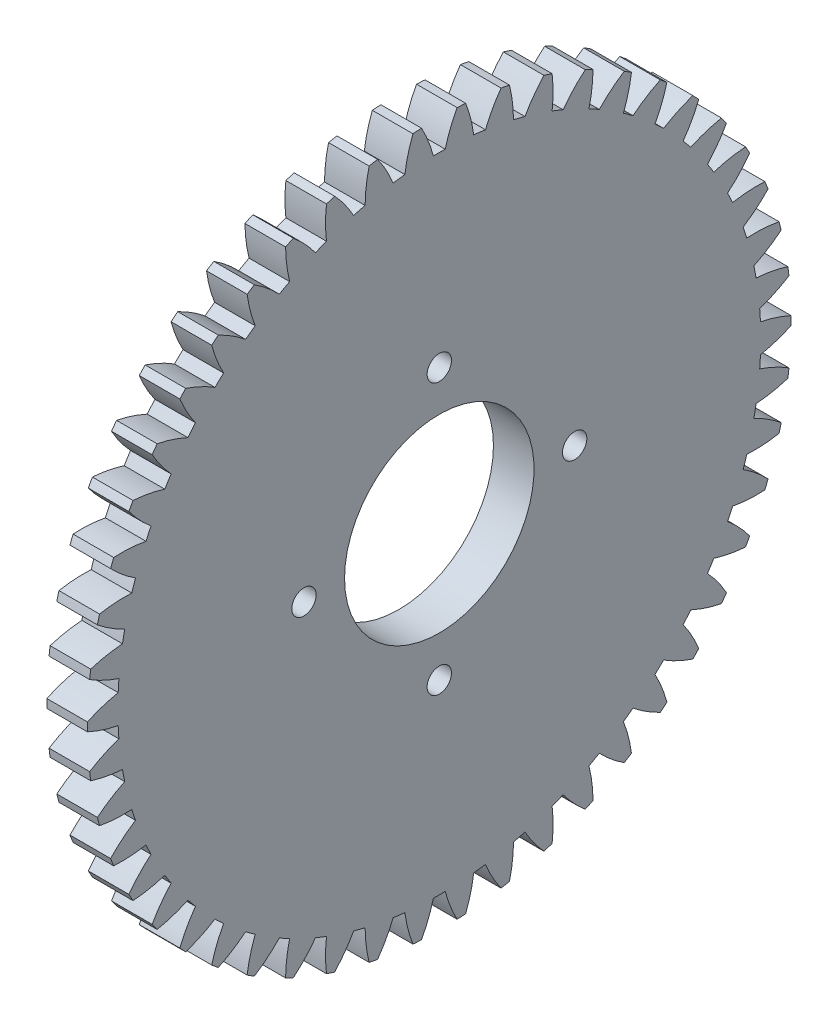
from build123d import *

# Parameters (mm, degrees)
BASPROSKE_W        = 3
BASPROSKE_H        = 26
TOOTHCUT_DEPTH     = 37.891733491
TEETHCUTS_COUNT    = 50
TEETHCUTS_ANGLE    = 352.8
HUBNEABOTSKE_R     = 0.5
HUBNEARBOTH_DEPTH  = 23.5000254
HUBFAR_START       = 23.5000254
HUBFARSKE_R        = 0.5
HUBFAR_DEPTH       = 23.5000254
BORSKE_R           = 7
BORE_DEPTH         = 50.0000508
SKETCH1_R          = 0.9
CUT_EXTRUDE1_DEPTH = 3


with BuildPart() as part:
    # BasProSke → Base-Revolve (revolve)
    with BuildSketch(Plane(origin=(0, 0, 0), x_dir=(1, 0, 0), z_dir=(0, 1, 0)), mode=Mode.PRIVATE) as base_revolve_sk:
        with Locations((1.5, 13)):
            Rectangle(BASPROSKE_W, BASPROSKE_H)
    revolve(base_revolve_sk.sketch.rotate(Axis((-10, 0, 0), (1, 0, 0)), 180), axis=Axis((-10, 0, 0), (1, 0, 0)))

    # TooCutSke → ToothCut (cut, through all)
    with BuildSketch(Plane(origin=(0, 0, 0), x_dir=(0, 0, -1), z_dir=(1, 0, 0))):
        with BuildLine():
            ThreePointArc((0.437663408, 23.744966872), (0, 23.749), (-0.437663408, 23.744966872))
            ThreePointArc((-0.437663408, 23.744966872), (-0.815428123, 24.895236298), (-1.329433358, 25.991422664))
            ThreePointArc((-1.329433358, 25.991422664), (0, 26.0254), (1.329433358, 25.991422664))
            ThreePointArc((1.329433358, 25.991422664), (0.815428123, 24.895236298), (0.437663408, 23.744966872))
        make_face()
    toothcut = extrude(amount=TOOTHCUT_DEPTH, mode=Mode.SUBTRACT)

    # TeethCuts: ToothCut ×50 about axis
    teethcuts_axis = Axis((-10, 0, 0), (1, 0, 0))
    for i in range(1, TEETHCUTS_COUNT):
        add(toothcut.rotate(teethcuts_axis, i * TEETHCUTS_ANGLE / (TEETHCUTS_COUNT - 1)), mode=Mode.SUBTRACT)

    # HubNeaBotSke → HubNearBoth (add)
    with BuildSketch(Plane.ZY):
        with Locations(Location((0, 0, 0), (0, 0, 180))):
            Circle(HUBNEABOTSKE_R)
    extrude(amount=HUBNEARBOTH_DEPTH)

    # HubFarSke → HubFar (add)
    with BuildSketch(Plane(origin=(3, 0, 0), x_dir=(0, 0, -1), z_dir=(1, 0, 0)).offset(HUBFAR_START)):
        Circle(HUBFARSKE_R)
    extrude(amount=-HUBFAR_DEPTH)

    # BorSke → Bore (cut, symmetric)
    with BuildSketch(Plane(origin=(0, 0, 0), x_dir=(0, 0, -1), z_dir=(1, 0, 0))):
        with Locations(Location((0, 0, 0), (0, 0, 180))):
            Circle(BORSKE_R)
    extrude(amount=BORE_DEPTH, both=True, mode=Mode.SUBTRACT)

    # Sketch1 → Cut-Extrude1 (cut)
    with BuildSketch(Plane(origin=(3, 0, 0), x_dir=(0, 0, -1), z_dir=(1, 0, 0))):
        with Locations((0, -10)):
            Circle(SKETCH1_R)
        with Locations((-10, 0)):
            Circle(SKETCH1_R)
        with Locations((0, 10)):
            Circle(SKETCH1_R)
        with Locations((10, 0)):
            Circle(SKETCH1_R)
    extrude(amount=-CUT_EXTRUDE1_DEPTH, mode=Mode.SUBTRACT)


solid = part.part
